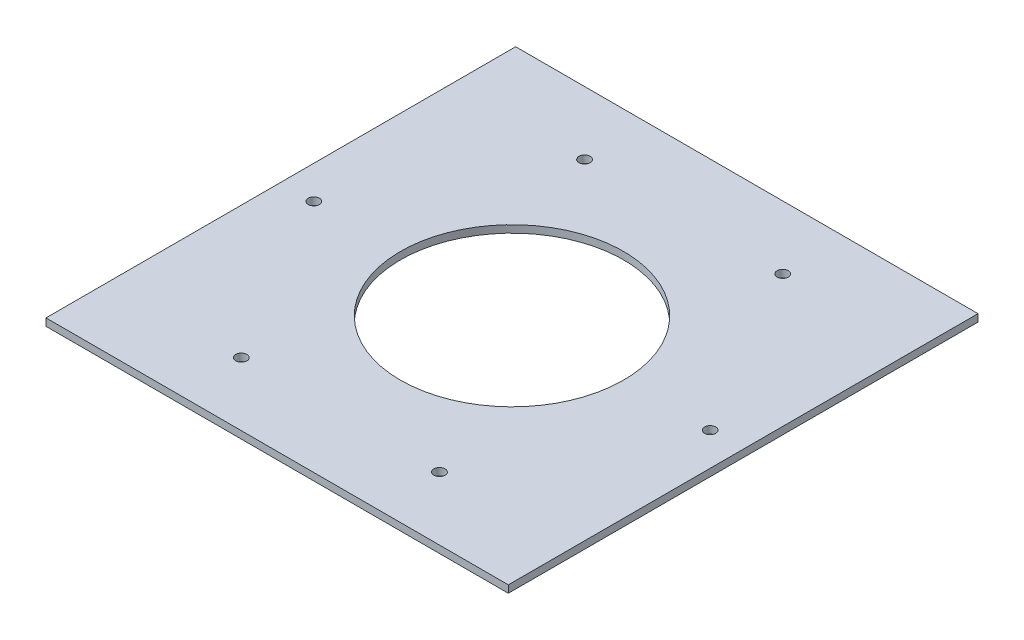
from build123d import *

# Parameters (mm, degrees)
SKETCH1_W           = 200.025
SKETCH1_H           = 203.2
SKETCH1_R           = 2.413
BOSS_EXTRUDE1_DEPTH = 3.175
SKETCH3_R           = 48.26
CUT_EXTRUDE1_DEPTH  = 143.601335131


with BuildPart() as part:
    # Sketch1 → Boss-Extrude1 (new body)
    with BuildSketch(Plane(origin=(0, 0, 0), x_dir=(1, 0, 0), z_dir=(0, 1, 0))):
        Rectangle(SKETCH1_W, SKETCH1_H)
        with Locations(Location((42.8625, 74.240027739, 0), (0, 0, 270))):
            Circle(SKETCH1_R, mode=Mode.SUBTRACT)
        with Locations(Location((85.725, 0, 0), (0, 0, 270))):
            Circle(SKETCH1_R, mode=Mode.SUBTRACT)
        with Locations(Location((42.8625, -74.240027739, 0), (0, 0, 270))):
            Circle(SKETCH1_R, mode=Mode.SUBTRACT)
        with Locations(Location((-42.8625, -74.240027739, 0), (0, 0, 270))):
            Circle(SKETCH1_R, mode=Mode.SUBTRACT)
        with Locations(Location((-85.725, 0, 0), (0, 0, 270))):
            Circle(SKETCH1_R, mode=Mode.SUBTRACT)
        with Locations(Location((-42.8625, 74.240027739, 0), (0, 0, 270))):
            Circle(SKETCH1_R, mode=Mode.SUBTRACT)
    extrude(amount=BOSS_EXTRUDE1_DEPTH)

    # Sketch3 → Cut-Extrude1 (cut, through all)
    with BuildSketch(Plane(origin=(0, 3.175, 0), x_dir=(1, 0, 0), z_dir=(0, 1, 0))):
        with Locations(Location((0, 0, 0), (0, 0, 270))):
            Circle(SKETCH3_R)
    extrude(amount=-CUT_EXTRUDE1_DEPTH, mode=Mode.SUBTRACT)


solid = part.part
